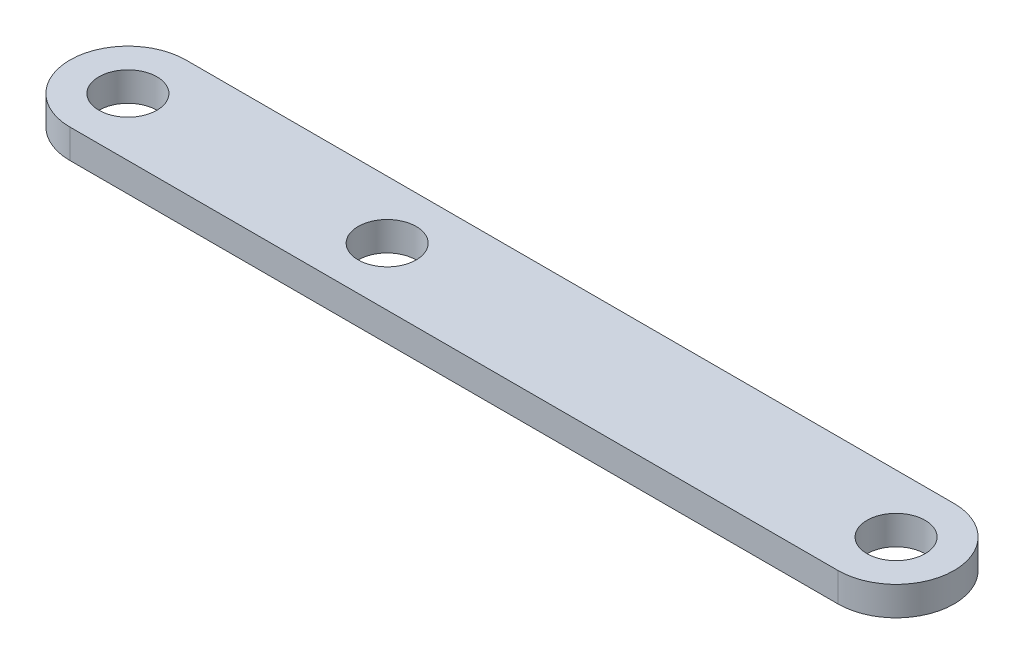
from build123d import *

# Parameters (mm, degrees)
SKETCH_1_R      = 3
EXTRUDE_1_DEPTH = 3


with BuildPart() as part:
    # 草图1 → 凸台-拉伸1 (new body)
    with BuildSketch(Plane(origin=(0, 0, 0), x_dir=(1, 0, 0), z_dir=(0, 1, 0))):
        with BuildLine():
            Line((0, 6), (79.41, 6))
            ThreePointArc((79.41, 6), (85.41, 0), (79.41, -6))
            Line((79.41, -6), (0, -6))
            ThreePointArc((0, -6), (-6, 0), (0, 6))
        make_face()
        with Locations(Location((0, 0, 0), (0, 0, 270))):
            Circle(SKETCH_1_R, mode=Mode.SUBTRACT)
        with Locations(Location((79.41, 0, 0), (0, 0, 270))):
            Circle(SKETCH_1_R, mode=Mode.SUBTRACT)
        with Locations(Location((26.8, 0, 0), (0, 0, 270))):
            Circle(SKETCH_1_R, mode=Mode.SUBTRACT)
    extrude(amount=EXTRUDE_1_DEPTH)


solid = part.part
